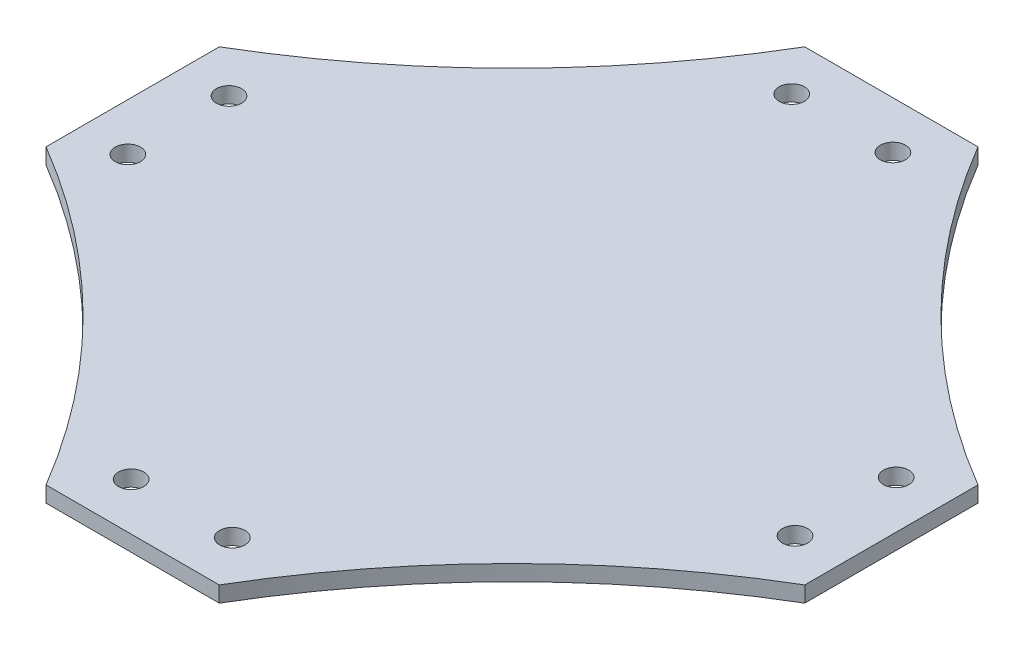
from build123d import *

# Parameters (mm, degrees)
BOSS_EXTRUDE1_DEPTH = 2.5
SKETCH3_R           = 2
CUT_EXTRUDE1_DEPTH  = 2.5
CIRPATTERN1_COUNT   = 4


with BuildPart() as part:
    # Sketch1 → Boss-Extrude1 (new body)
    with BuildSketch(Plane(origin=(0, 0, 0), x_dir=(1, 0, 0), z_dir=(0, 1, 0))):
        with BuildLine():
            Line((-13.7, 60), (13.7, 60))
            ThreePointArc((13.7, 60), (33.917107936, 33.917107936), (60, 13.7))
            Line((60, 13.7), (60, -13.7))
            ThreePointArc((60, -13.7), (33.917107936, -33.917107936), (13.7, -60))
            Line((13.7, -60), (-13.7, -60))
            ThreePointArc((-13.7, -60), (-33.917107936, -33.917107936), (-60, -13.7))
            Line((-60, -13.7), (-60, 13.7))
            ThreePointArc((-60, 13.7), (-33.917107936, 33.917107936), (-13.7, 60))
        make_face()
    extrude(amount=BOSS_EXTRUDE1_DEPTH)

    # Sketch3 → Cut-Extrude1 (cut)
    with BuildSketch(Plane(origin=(0, 2.5, 0), x_dir=(1, 0, 0), z_dir=(0, 1, 0))):
        with Locations((-8.259716624, 52.5)):
            Circle(SKETCH3_R)
        with Locations((7.740283376, 52.5)):
            Circle(SKETCH3_R)
    cut_extrude1 = extrude(amount=-CUT_EXTRUDE1_DEPTH, mode=Mode.SUBTRACT)

    # CirPattern1: Cut-Extrude1 ×4 about axis
    cirpattern1_axis = Axis((0, 0, 0), (0, 1, 0))
    for i in range(1, CIRPATTERN1_COUNT):
        add(cut_extrude1.rotate(cirpattern1_axis, i * 360 / CIRPATTERN1_COUNT), mode=Mode.SUBTRACT)


solid = part.part
